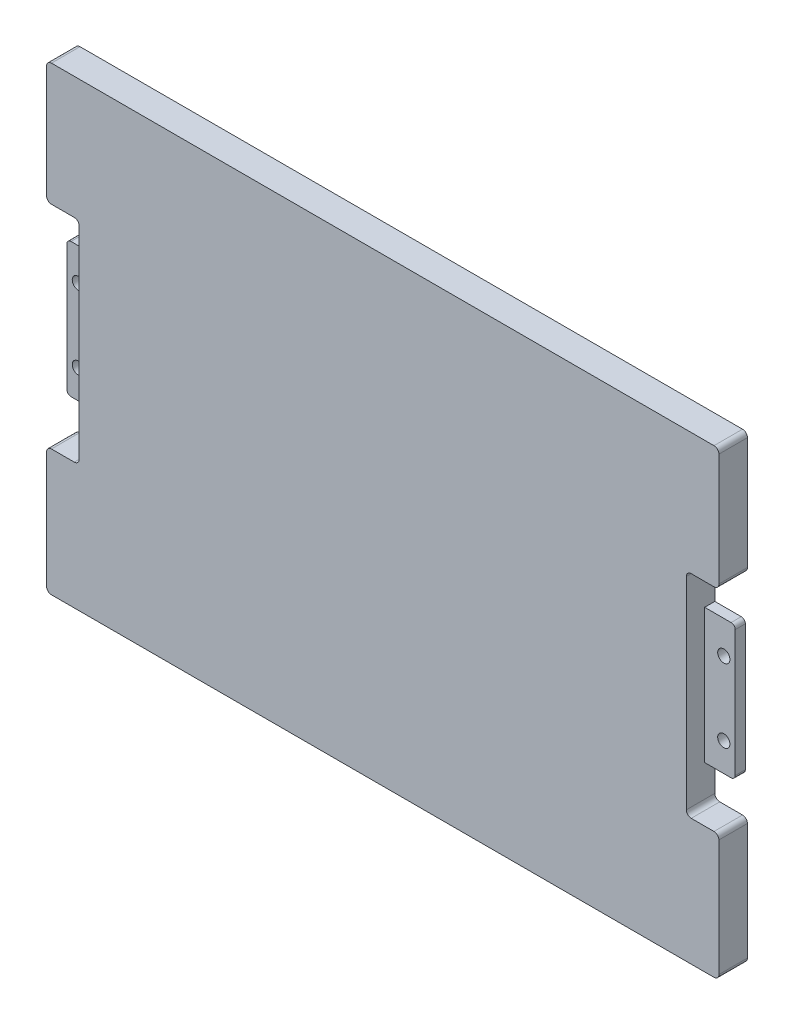
from build123d import *

# Parameters (mm, degrees)
EXTRUDE_1_DEPTH     = 7
SKETCH_2_R          = 6
CUT_EXTRUDE_1_DEPTH = 5
CUT_EXTRUDE_2_DEPTH = 0.5
FILLET_1_R          = 1
SKETCH_4_R          = 1.5
EXTRUDE_3_DEPTH     = 2.5
SKETCH_5_W          = 1.5
SKETCH_5_H          = 4.3
CUT_EXTRUDE_3_DEPTH = 2.5
SKETCH_6_W          = 3.174285876
SKETCH_6_H          = 3
CUT_EXTRUDE_4_DEPTH = 1


with BuildPart() as part:
    # Эскиз1 → Бобышка-Вытянуть1 (new body)
    with BuildSketch(Plane.XY):
        with BuildLine():
            Line((1.201755047, 83), (6.798244953, 83))
            ThreePointArc((6.798244953, 83), (7.648014096, 82.648014096), (8, 81.798244953))
            Line((8, 81.798244953), (8, 32.201755047))
            ThreePointArc((8, 32.201755047), (7.648014096, 31.351985904), (6.798244953, 31))
            Line((6.798244953, 31), (1.201755047, 31))
            ThreePointArc((1.201755047, 31), (0.351985904, 30.648014096), (0, 29.798244953))
            Line((0, 29.798244953), (0, 1.201755047))
            ThreePointArc((0, 1.201755047), (0.351985904, 0.351985904), (1.201755047, 0))
            Line((1.201755047, 0), (163.798244953, 0))
            ThreePointArc((163.798244953, 0), (164.648014096, 0.351985904), (165, 1.201755047))
            Line((165, 1.201755047), (165, 29.798244953))
            ThreePointArc((165, 29.798244953), (164.648014096, 30.648014096), (163.798244953, 31))
            Line((163.798244953, 31), (158.201755047, 31))
            ThreePointArc((158.201755047, 31), (157.351985904, 31.351985904), (157, 32.201755047))
            Line((157, 32.201755047), (157, 81.798244953))
            ThreePointArc((157, 81.798244953), (157.351985904, 82.648014096), (158.201755047, 83))
            Line((158.201755047, 83), (163.798244953, 83))
            ThreePointArc((163.798244953, 83), (164.648014096, 83.351985904), (165, 84.201755047))
            Line((165, 84.201755047), (165, 111.798244953))
            ThreePointArc((165, 111.798244953), (164.648014096, 112.648014096), (163.798244953, 113))
            Line((163.798244953, 113), (1.201755047, 113))
            ThreePointArc((1.201755047, 113), (0.351985904, 112.648014096), (0, 111.798244953))
            Line((0, 111.798244953), (0, 84.201755047))
            ThreePointArc((0, 84.201755047), (0.351985904, 83.351985904), (1.201755047, 83))
        make_face()
    extrude(amount=EXTRUDE_1_DEPTH)

    # Эскиз2 → Вырез-Вытянуть1 (cut)
    with BuildSketch(Plane(origin=(0, 0, 0), x_dir=(-1, 0, 0), z_dir=(0, 0, -1))):
        with BuildLine():
            Line((-161.798244953, 111), (-3.201755047, 111))
            ThreePointArc((-3.201755047, 111), (-2.351985904, 110.648014096), (-2, 109.798244953))
            Line((-2, 109.798244953), (-2, 86.201755047))
            ThreePointArc((-2, 86.201755047), (-2.351985904, 85.351985904), (-3.201755047, 85))
            Line((-3.201755047, 85), (-8.798244953, 85))
            ThreePointArc((-8.798244953, 85), (-9.648014096, 84.648014096), (-10, 83.798244953))
            Line((-10, 83.798244953), (-10, 30.201755047))
            ThreePointArc((-10, 30.201755047), (-9.648014096, 29.351985904), (-8.798244953, 29))
            Line((-8.798244953, 29), (-3.201755047, 29))
            ThreePointArc((-3.201755047, 29), (-2.351985904, 28.648014096), (-2, 27.798244953))
            Line((-2, 27.798244953), (-2, 3.201755047))
            ThreePointArc((-2, 3.201755047), (-2.351985904, 2.351985904), (-3.201755047, 2))
            Line((-3.201755047, 2), (-161.798244953, 2))
            ThreePointArc((-161.798244953, 2), (-162.648014096, 2.351985904), (-163, 3.201755047))
            Line((-163, 3.201755047), (-163, 27.798244953))
            ThreePointArc((-163, 27.798244953), (-162.648014096, 28.648014096), (-161.798244953, 29))
            Line((-161.798244953, 29), (-156.201755047, 29))
            ThreePointArc((-156.201755047, 29), (-155.351985904, 29.351985904), (-155, 30.201755047))
            Line((-155, 30.201755047), (-155, 70.5))
            Line((-155, 70.5), (-155, 74.8))
            Line((-155, 74.8), (-155, 83.798244953))
            ThreePointArc((-155, 83.798244953), (-155.351985904, 84.648014096), (-156.201755047, 85))
            Line((-156.201755047, 85), (-161.798244953, 85))
            ThreePointArc((-161.798244953, 85), (-162.648014096, 85.351985904), (-163, 86.201755047))
            Line((-163, 86.201755047), (-163, 109.798244953))
            ThreePointArc((-163, 109.798244953), (-162.648014096, 110.648014096), (-161.798244953, 111))
        make_face()
        with Locations((-82.5, 57)):
            Circle(SKETCH_2_R, mode=Mode.SUBTRACT)
    extrude(amount=-CUT_EXTRUDE_1_DEPTH, mode=Mode.SUBTRACT)

    # Эскиз3 → Вырез-Вытянуть2 (cut)
    # profile 1 of 2: a face of its own
    with BuildSketch(Plane(origin=(0, 0, 5), x_dir=(-1, 0, 0), z_dir=(0, 0, -1))):
        with BuildLine():
            Line((-120, 31), (-103, 31))
            ThreePointArc((-103, 31), (-102.292893219, 30.707106781), (-102, 30))
            Line((-102, 30), (-102, 19))
            ThreePointArc((-102, 19), (-102.292893219, 18.292893219), (-103, 18))
            Line((-103, 18), (-120, 18))
            ThreePointArc((-120, 18), (-120.707106781, 18.292893219), (-121, 19))
            Line((-121, 19), (-121, 30))
            ThreePointArc((-121, 30), (-120.707106781, 30.707106781), (-120, 31))
        make_face()
    # profile 2 of 2: a face of its own
    with BuildSketch(Plane(origin=(0, 0, 5), x_dir=(-1, 0, 0), z_dir=(0, 0, -1))):
        with BuildLine():
            Line((-52.1501229, 97.239252875), (-39.1501229, 97.239252875))
            ThreePointArc((-39.1501229, 97.239252875), (-38.443016119, 96.946359657), (-38.1501229, 96.239252875))
            Line((-38.1501229, 96.239252875), (-38.1501229, 83.239252875))
            ThreePointArc((-38.1501229, 83.239252875), (-38.443016119, 82.532146094), (-39.1501229, 82.239252875))
            Line((-39.1501229, 82.239252875), (-52.1501229, 82.239252875))
            ThreePointArc((-52.1501229, 82.239252875), (-52.857229681, 82.532146094), (-53.1501229, 83.239252875))
            Line((-53.1501229, 83.239252875), (-53.1501229, 96.239252875))
            ThreePointArc((-53.1501229, 96.239252875), (-52.857229681, 96.946359657), (-52.1501229, 97.239252875))
        make_face()
        Polygon((-41.403231286, 94.64375803), (-44.490035641, 94.64375803), (-48.784719961, 93.637191392), (-48.784719961, 92.630624755), (-44.490035641, 93.637191392), (-41.403231286, 93.637191392), align=None, mode=Mode.SUBTRACT)
        Polygon((-48.784719961, 91.774831443), (-44.490035641, 92.630624755), (-44.490035641, 91.774831443), (-48.784719961, 90.91903813), align=None, mode=Mode.SUBTRACT)
        Polygon((-48.784719961, 90.055112789), (-44.490035641, 90.910906102), (-44.490035641, 90.055112789), (-48.784719961, 89.067866896), align=None, mode=Mode.SUBTRACT)
        Polygon((-48.784719961, 88.216527408), (-44.490035641, 89.067866896), (-41.403231286, 89.067866896), (-41.403231286, 88.316883581), (-44.341167482, 88.316883581), (-48.784719961, 87.436033812), align=None, mode=Mode.SUBTRACT)
        Polygon((-48.609605566, 93.888102843), (-44.858812452, 94.806018458), (-44.858812452, 95.913847648), (-46.734209009, 95.170019477), (-48.609605566, 95.739760204), align=None, mode=Mode.SUBTRACT)
        Polygon((-48.609605566, 87.006809767), (-44.858812452, 87.715709289), (-44.858812452, 86.328076183), (-46.734209009, 86.674984459), (-48.609605566, 85.770006347), align=None, mode=Mode.SUBTRACT)
    extrude(amount=-CUT_EXTRUDE_2_DEPTH, mode=Mode.SUBTRACT)

    # Скругление1
    fillet_1_edges = [part.edges().sort_by_distance(p)[0] for p in [
        (155, 57, 5),
        (155.351985904, 84.648014096, 5),
        (159, 85, 5),
        (162.648014096, 85.351985904, 5),
        (163, 98, 5),
        (162.648014096, 110.648014096, 5),
        (82.5, 111, 5),
        (2.351985904, 110.648014096, 5),
        (2, 98, 5),
        (2.351985904, 85.351985904, 5),
        (6, 85, 5),
        (9.648014096, 84.648014096, 5),
        (10, 57, 5),
        (9.648014096, 29.351985904, 5),
        (6, 29, 5),
        (2.351985904, 28.648014096, 5),
        (2, 15.5, 5),
        (2.351985904, 2.351985904, 5),
        (82.5, 2, 5),
        (162.648014096, 2.351985904, 5),
        (163, 15.5, 5),
        (162.648014096, 28.648014096, 5),
        (159, 29, 5),
        (155.351985904, 29.351985904, 5),
    ]]
    fillet(fillet_1_edges, radius=FILLET_1_R)

    # Эскиз4 → Бобышка-Вытянуть3 (add)
    # profile 1 of 2: a face of its own
    with BuildSketch(Plane(origin=(0, 0, 0), x_dir=(-1, 0, 0), z_dir=(0, 0, -1))):
        with BuildLine():
            Line((-157, 73), (-163.5, 73))
            ThreePointArc((-163.5, 73), (-164.207106781, 72.707106781), (-164.5, 72))
            Line((-164.5, 72), (-164.5, 41))
            ThreePointArc((-164.5, 41), (-164.207106781, 40.292893219), (-163.5, 40))
            Line((-163.5, 40), (-157, 40))
            Line((-157, 40), (-157, 73))
        make_face()
        with Locations((-161.7, 47)):
            Circle(SKETCH_4_R, mode=Mode.SUBTRACT)
        with Locations((-161.7, 65)):
            Circle(SKETCH_4_R, mode=Mode.SUBTRACT)
    # profile 2 of 2: a face of its own
    with BuildSketch(Plane(origin=(0, 0, 0), x_dir=(-1, 0, 0), z_dir=(0, 0, -1))):
        with BuildLine():
            Line((-1.5, 73), (-8, 73))
            Line((-8, 73), (-8, 40))
            Line((-8, 40), (-1.5, 40))
            ThreePointArc((-1.5, 40), (-0.792893219, 40.292893219), (-0.5, 41))
            Line((-0.5, 41), (-0.5, 72))
            ThreePointArc((-0.5, 72), (-0.792893219, 72.707106781), (-1.5, 73))
        make_face()
        with Locations((-3.3, 47)):
            Circle(SKETCH_4_R, mode=Mode.SUBTRACT)
        with Locations((-3.3, 65)):
            Circle(SKETCH_4_R, mode=Mode.SUBTRACT)
    extrude(amount=-EXTRUDE_3_DEPTH)

    # Эскиз5 → Вырез-Вытянуть3 (cut)
    with BuildSketch(Plane(origin=(0, 0, 0), x_dir=(-1, 0, 0), z_dir=(0, 0, -1))):
        with Locations((-155.75, 72.65)):
            Rectangle(SKETCH_5_W, SKETCH_5_H)
    extrude(amount=-CUT_EXTRUDE_3_DEPTH, mode=Mode.SUBTRACT)

    # Эскиз6 → Вырез-Вытянуть4 (cut)
    with BuildSketch(Plane(origin=(0, 0, 0), x_dir=(-1, 0, 0), z_dir=(0, 0, -1))):
        with Locations((-156.587142938, 81.5)):
            Rectangle(SKETCH_6_W, SKETCH_6_H)
    extrude(amount=-CUT_EXTRUDE_4_DEPTH, mode=Mode.SUBTRACT)


solid = part.part
